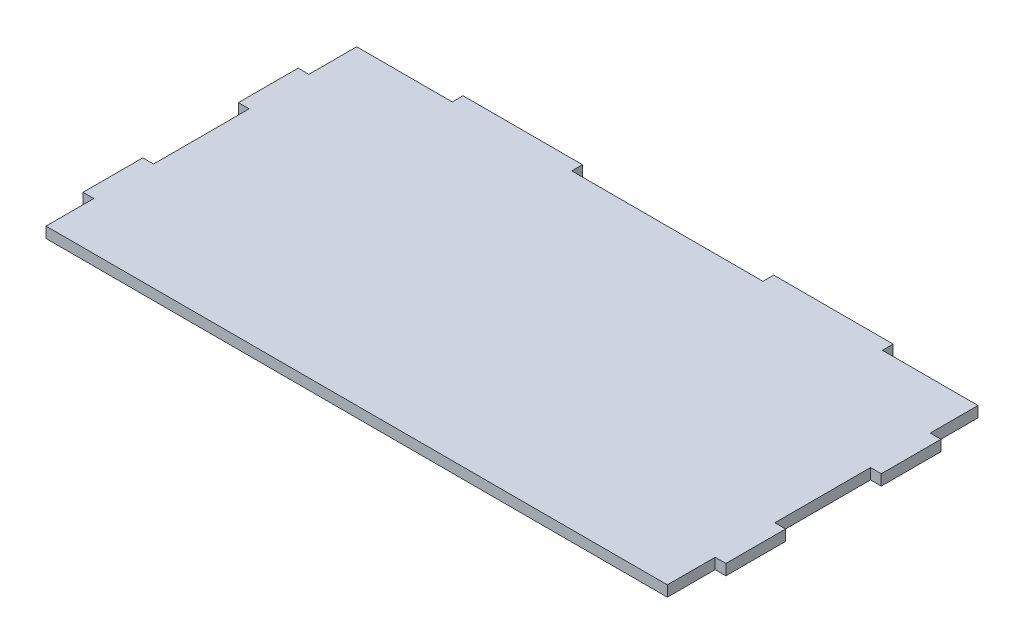
from build123d import *

# Parameters (mm, degrees)
BOSS_EXTRUDE1_DEPTH = 4.5


with BuildPart() as part:
    # Sketch1 → Boss-Extrude1 (new body)
    with BuildSketch(Plane(origin=(0, 0, 0), x_dir=(1, 0, 0), z_dir=(0, 1, 0))):
        Polygon((-120.769894135, 92.593269483), (-80.769894135, 92.593269483), (-80.769894135, 97.093269483), (-30.769894135, 97.093269483), (-30.769894135, 92.593269483), (49.230105865, 92.593269483), (49.230105865, 97.093269483), (99.230105865, 97.093269483), (99.230105865, 92.593269483), (139.230105865, 92.593269483), (139.230105865, 72.593269483), (143.730105865, 72.593269483), (143.730105865, 47.593269483), (139.230105865, 47.593269483), (139.230105865, 7.593269483), (143.730105865, 7.593269483), (143.730105865, -17.406730517), (139.230105865, -17.406730517), (139.230105865, -37.406730517), (-120.769894135, -37.406730517), (-120.769894135, -17.406730517), (-125.269894135, -17.406730517), (-125.269894135, 7.593269483), (-120.769894135, 7.593269483), (-120.769894135, 47.593269483), (-125.269894135, 47.593269483), (-125.269894135, 72.593269483), (-120.769894135, 72.593269483), align=None)
    extrude(amount=BOSS_EXTRUDE1_DEPTH)


solid = part.part
